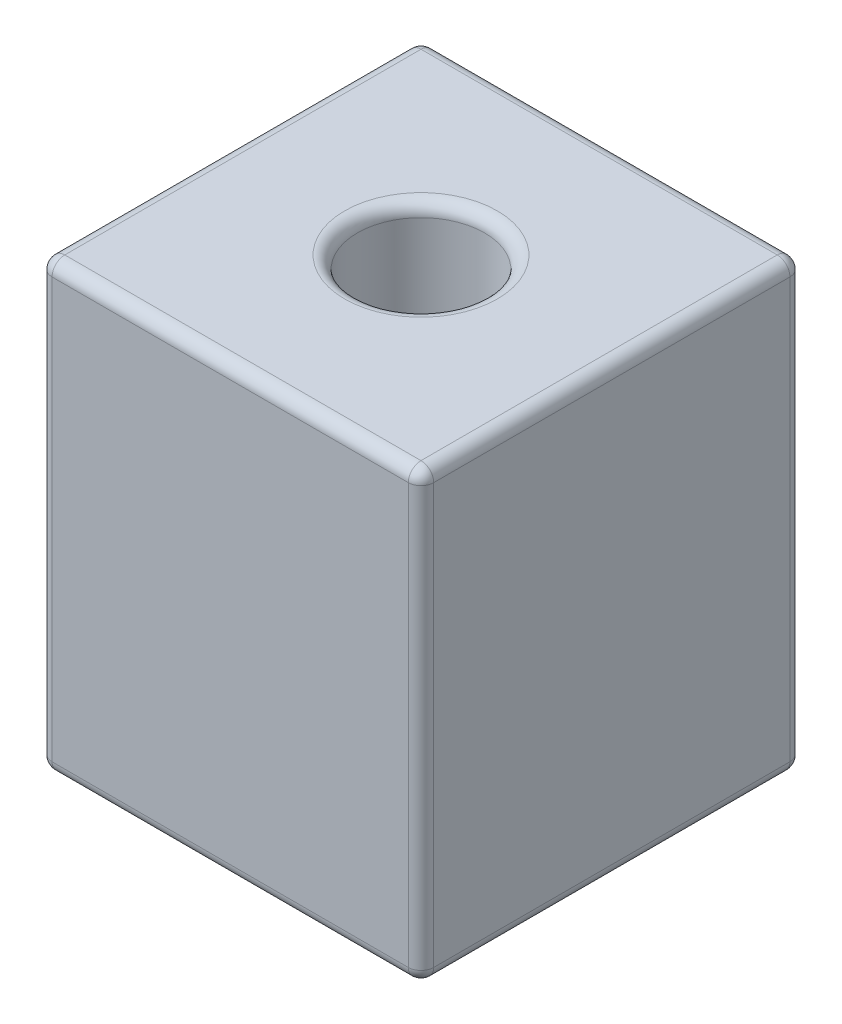
from build123d import *

# Parameters (mm, degrees)
SKETCH1_W           = 30
SKETCH1_H           = 35
BOSS_EXTRUDE1_DEPTH = 30
SKETCH2_R           = 5
CUT_EXTRUDE1_DEPTH  = 30
FILLET2_R           = 1


with BuildPart() as part:
    # Sketch1 → Boss-Extrude1 (new body)
    with BuildSketch(Plane.XY):
        Rectangle(SKETCH1_W, SKETCH1_H)
    extrude(amount=BOSS_EXTRUDE1_DEPTH)

    # Sketch2 → Cut-Extrude1 (cut)
    with BuildSketch(Plane(origin=(0, 17.5, 0), x_dir=(1, 0, 0), z_dir=(0, 1, 0))):
        with Locations(Location((0, -15, 0), (0, 0, 270))):
            Circle(SKETCH2_R)
    extrude(amount=-CUT_EXTRUDE1_DEPTH, mode=Mode.SUBTRACT)

    # Fillet2
    fillet2_edges = [part.edges().sort_by_distance(p)[0] for p in [
        (-15, 0, 30),
        (0, -17.5, 30),
        (0, -12.5, 10),
        (0, 17.5, 10),
        (15, 0, 30),
        (0, -17.5, 0),
        (-15, 0, 0),
        (0, 17.5, 0),
        (15, 0, 0),
        (0, 17.5, 30),
        (15, -17.5, 15),
        (-15, -17.5, 15),
        (-15, 17.5, 15),
        (15, 17.5, 15),
    ]]
    fillet(fillet2_edges, radius=FILLET2_R)


solid = part.part
